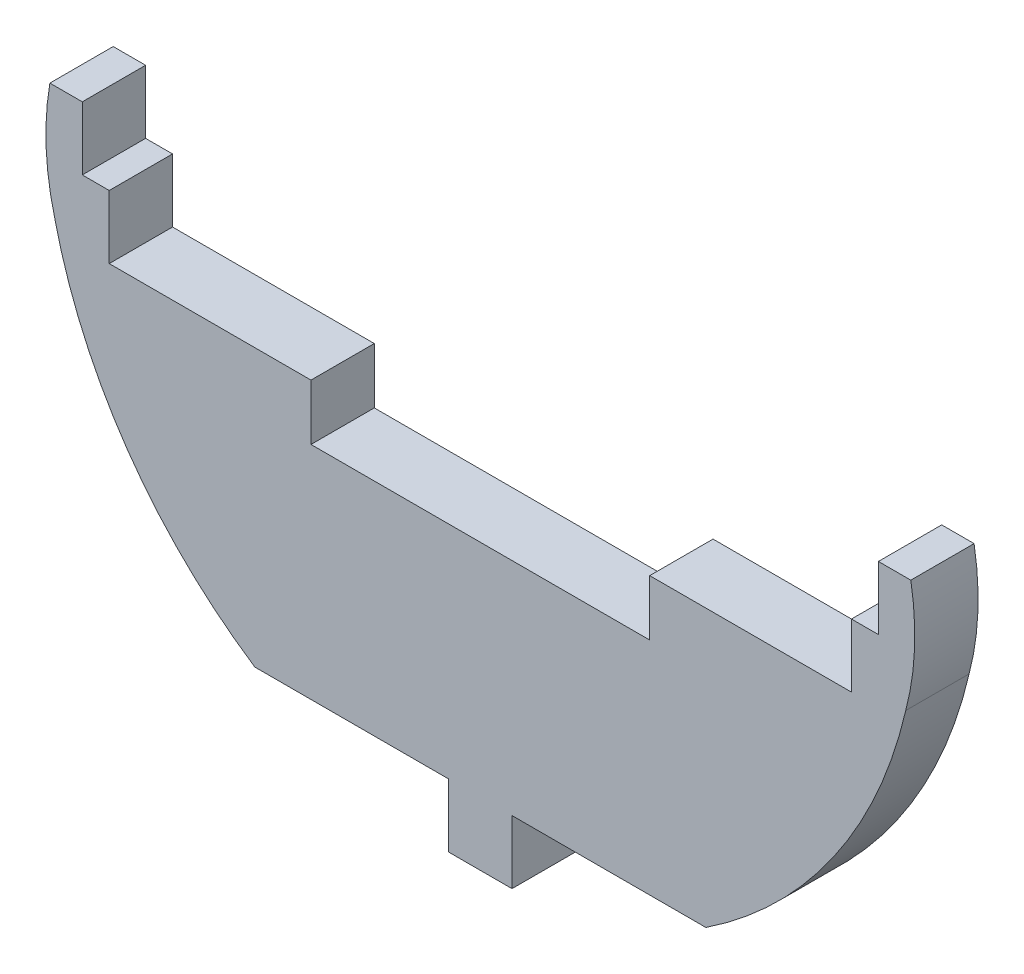
from build123d import *

# Parameters (mm, degrees)
BOSS_EXTRUDE1_DEPTH = 3


with BuildPart() as part:
    # Sketch1 → Boss-Extrude1 (new body)
    with BuildSketch(Plane.XY):
        with BuildLine():
            Line((8.024, 16.106), (8.024, 13.464))
            Line((8.024, 13.464), (-8.024, 13.464))
            Line((-8.024, 13.464), (-8.024, 16.106))
            Line((-8.024, 16.106), (-17.583, 16.106))
            Line((-17.583, 16.106), (-17.583, 19.106))
            Line((-17.583, 19.106), (-18.859, 19.106))
            Line((-18.859, 19.106), (-18.859, 22.106))
            Line((-18.859, 22.106), (-20.394542528, 22.106))
            ThreePointArc((-20.394542528, 22.106), (-20.571042392, 19.357451914), (-20.154, 16.635))
            ThreePointArc((-20.154, 16.635), (-16.727003231, 8.90904451), (-10.684, 3))
            Line((-10.684, 3), (-1.5, 3))
            Line((-1.5, 3), (-1.5, 0))
            Line((-1.5, 0), (1.5, 0))
            Line((1.5, 0), (1.5, 3))
            Line((1.5, 3), (10.684, 3))
            ThreePointArc((10.684, 3), (16.727003231, 8.90904451), (20.154, 16.635))
            ThreePointArc((20.154, 16.635), (20.571042392, 19.357451914), (20.394542528, 22.106))
            Line((20.394542528, 22.106), (18.859, 22.106))
            Line((18.859, 22.106), (18.859, 19.106))
            Line((18.859, 19.106), (17.583, 19.106))
            Line((17.583, 19.106), (17.583, 16.106))
            Line((17.583, 16.106), (8.024, 16.106))
        make_face()
    extrude(amount=BOSS_EXTRUDE1_DEPTH)


solid = part.part
